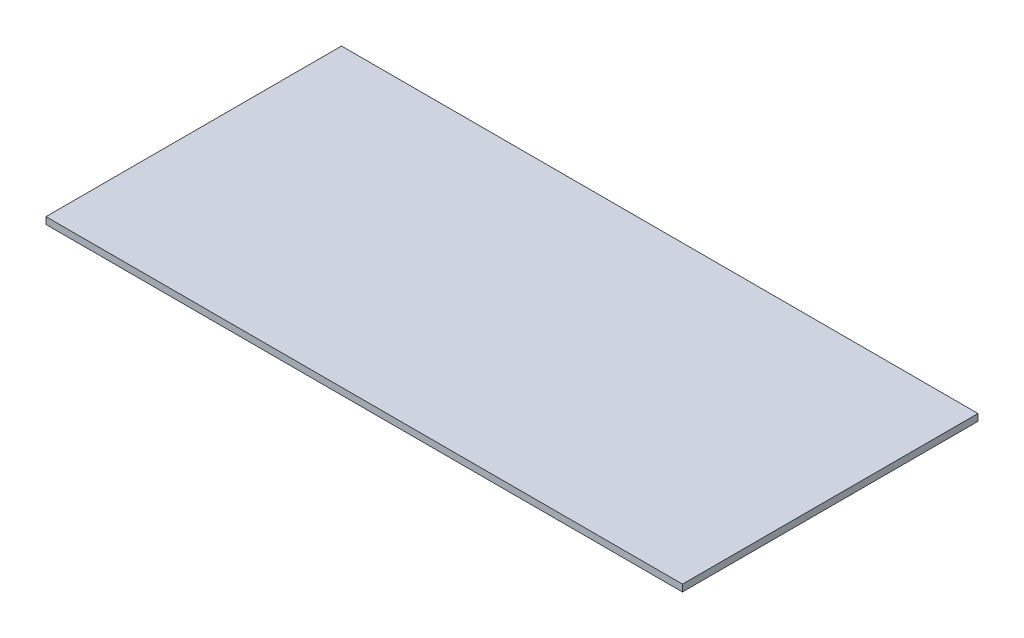
from build123d import *

# Parameters (mm, degrees)
SKETCH1_W           = 280
SKETCH1_H           = 130
BOSS_EXTRUDE1_DEPTH = 3


with BuildPart() as part:
    # Sketch1 → Boss-Extrude1 (new body)
    with BuildSketch(Plane(origin=(0, 0, 0), x_dir=(1, 0, 0), z_dir=(0, 1, 0))):
        with Locations((-140, -19.410958904)):
            Rectangle(SKETCH1_W, SKETCH1_H)
    extrude(amount=BOSS_EXTRUDE1_DEPTH)


solid = part.part
